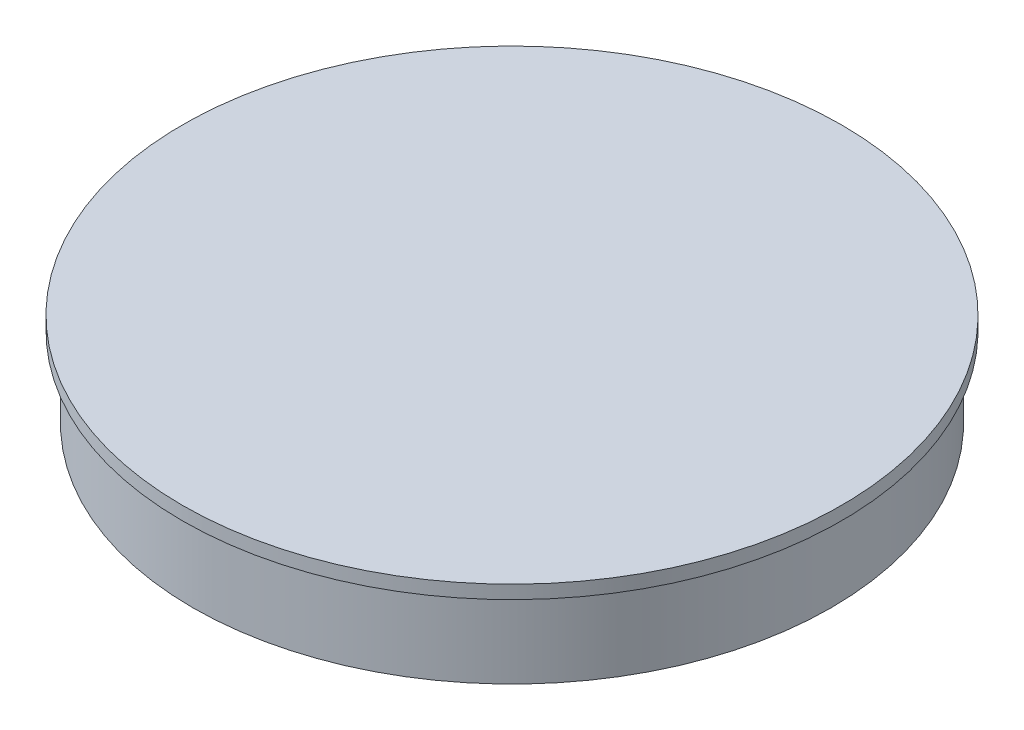
from build123d import *

# Parameters (mm, degrees)
SKETCH1_R           = 35.75
SKETCH1_R_2         = 34.75
BOSS_EXTRUDE1_DEPTH = 9
SKETCH2_R           = 36.9
BOSS_EXTRUDE2_DEPTH = 1.5


with BuildPart() as part:
    # Sketch1 → Boss-Extrude1 (new body)
    with BuildSketch(Plane(origin=(0, 0, 0), x_dir=(1, 0, 0), z_dir=(0, 1, 0))):
        with Locations(Location((0, 0, 0), (0, 0, 270))):
            Circle(SKETCH1_R)
        with Locations(Location((0, 0, 0), (0, 0, 270))):
            Circle(SKETCH1_R_2, mode=Mode.SUBTRACT)
    extrude(amount=BOSS_EXTRUDE1_DEPTH)

    # Sketch2 → Boss-Extrude2 (add)
    with BuildSketch(Plane(origin=(0, 9, 0), x_dir=(1, 0, 0), z_dir=(0, 1, 0))):
        with Locations(Location((0, 0, 0), (0, 0, 270))):
            Circle(SKETCH2_R)
    extrude(amount=BOSS_EXTRUDE2_DEPTH)


solid = part.part
